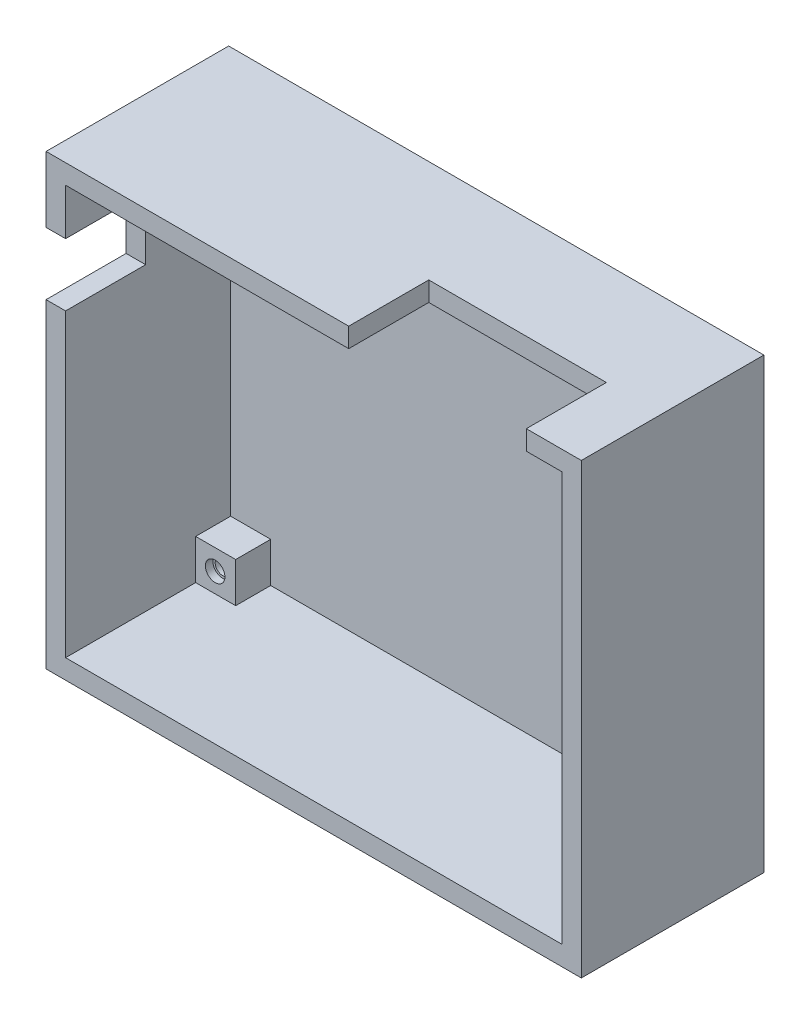
from build123d import *

# Parameters (mm, degrees)
ESBO_O1_W                = 107
ESBO_O1_H                = 89.6
RESSALTO_EXTRUS_O2_DEPTH = 36.5
CORTE_EXTRUS_O2_DEPTH    = 33
ESBO_O4_W                = 8
ESBO_O4_H                = 8
CORTE_EXTRUS_O3_DEPTH    = 26
ESBO_O5_W                = 83.2
ESBO_O5_H                = 3.9
ESBO_O5_H_2              = 4.1
CORTE_EXTRUS_O4_DEPTH    = 33
ESBO_O6_W                = 83.2
ESBO_O6_H                = 3.9
CORTE_EXTRUS_O5_DEPTH    = 33
ESBO_O7_W                = 35.5
ESBO_O7_H                = 3.9
CORTE_EXTRUS_O6_DEPTH    = 16
ESBO_O9_W                = 3.9
ESBO_O9_H                = 12.5
CORTE_EXTRUS_O7_DEPTH    = 16
ESBO_O10_R               = 1.95
CORTE_EXTRUS_O8_DEPTH    = 1.5
ESBO_O11_R               = 1.95
CORTE_EXTRUS_O9_DEPTH    = 1.5
ESBO_O12_R               = 1.95
CORTE_EXTRUS_O10_DEPTH   = 1.5
ESBO_O13_R               = 1.95
CORTE_EXTRUS_O11_DEPTH   = 1.5
ESBO_O14_R               = 1.5
CORTE_EXTRUS_O12_DEPTH   = 7
ESBO_O15_R               = 1.5
CORTE_EXTRUS_O13_DEPTH   = 7
ESBO_O16_R               = 1.5
CORTE_EXTRUS_O14_DEPTH   = 7
ESBO_O17_R               = 1.5
CORTE_EXTRUS_O15_DEPTH   = 7


with BuildPart() as part:
    # Esboço1 → Ressalto-extrusão2 (new body)
    with BuildSketch(Plane.XY):
        with Locations((53.5, -44.8)):
            Rectangle(ESBO_O1_W, ESBO_O1_H)
    extrude(amount=RESSALTO_EXTRUS_O2_DEPTH)

    # Esboço3 → Corte-extrusão2 (cut)
    with BuildSketch(Plane.XY.offset(36.5)):
        Polygon((95.1, -77.7), (95.1, -81.8), (11.9, -81.8), (11.9, -77.7), (7.8, -77.7), (3.9, -77.7), (3.9, -11.9), (11.9, -11.9), (11.9, -7.8), (95.1, -7.8), (95.1, -11.9), (99.2, -11.9), (103.1, -11.9), (103.1, -77.7), (99.2, -77.7), align=None)
    extrude(amount=-CORTE_EXTRUS_O2_DEPTH, mode=Mode.SUBTRACT)

    # Esboço4 → Corte-extrusão3 (cut)
    with BuildSketch(Plane.XY.offset(36.5)):
        Polygon((3.9, -11.9), (3.9, -3.9), (11.9, -3.9), (11.9, -7.8), (11.9, -11.9), align=None)
        Polygon((103.1, -11.9), (103.1, -3.9), (95.1, -3.9), (95.1, -7.8), (95.1, -11.9), align=None)
        with Locations((7.9, -81.7)):
            Rectangle(ESBO_O4_W, ESBO_O4_H)
        with Locations((99.1, -81.7)):
            Rectangle(ESBO_O4_W, ESBO_O4_H)
    extrude(amount=-CORTE_EXTRUS_O3_DEPTH, mode=Mode.SUBTRACT)

    # Esboço5 → Corte-extrusão4 (cut)
    with BuildSketch(Plane.XY.offset(36.5)):
        with Locations((53.5, -5.85)):
            Rectangle(ESBO_O5_W, ESBO_O5_H)
        with Locations((53.5, -79.75)):
            Rectangle(ESBO_O5_W, ESBO_O5_H_2)
    extrude(amount=-CORTE_EXTRUS_O4_DEPTH, mode=Mode.SUBTRACT)

    # Esboço6 → Corte-extrusão5 (cut)
    with BuildSketch(Plane.XY.offset(36.5)):
        with Locations((53.5, -83.75)):
            Rectangle(ESBO_O6_W, ESBO_O6_H)
    extrude(amount=-CORTE_EXTRUS_O5_DEPTH, mode=Mode.SUBTRACT)

    # Esboço7 → Corte-extrusão6 (cut)
    with BuildSketch(Plane.XY.offset(36.5)):
        with Locations((78.25, -1.95)):
            Rectangle(ESBO_O7_W, ESBO_O7_H)
    extrude(amount=-CORTE_EXTRUS_O6_DEPTH, mode=Mode.SUBTRACT)

    # Esboço9 → Corte-extrusão7 (cut)
    with BuildSketch(Plane.XY.offset(36.5)):
        with Locations((1.95, -19.41)):
            Rectangle(ESBO_O9_W, ESBO_O9_H)
    extrude(amount=-CORTE_EXTRUS_O7_DEPTH, mode=Mode.SUBTRACT)

    # Esboço10 → Corte-extrusão8 (cut)
    with BuildSketch(Plane.XY.offset(10.5)):
        with Locations((7.8, -7.8)):
            Circle(ESBO_O10_R)
    extrude(amount=-CORTE_EXTRUS_O8_DEPTH, mode=Mode.SUBTRACT)

    # Esboço11 → Corte-extrusão9 (cut)
    with BuildSketch(Plane.XY.offset(10.5)):
        with Locations((99.2, -7.8)):
            Circle(ESBO_O11_R)
    extrude(amount=-CORTE_EXTRUS_O9_DEPTH, mode=Mode.SUBTRACT)

    # Esboço12 → Corte-extrusão10 (cut)
    with BuildSketch(Plane.XY.offset(10.5)):
        with Locations((99.2, -81.8)):
            Circle(ESBO_O12_R)
    extrude(amount=-CORTE_EXTRUS_O10_DEPTH, mode=Mode.SUBTRACT)

    # Esboço13 → Corte-extrusão11 (cut)
    with BuildSketch(Plane.XY.offset(10.5)):
        with Locations((7.8, -81.8)):
            Circle(ESBO_O13_R)
    extrude(amount=-CORTE_EXTRUS_O11_DEPTH, mode=Mode.SUBTRACT)

    # Esboço14 → Corte-extrusão12 (cut)
    with BuildSketch(Plane.XY.offset(9)):
        with Locations((7.8, -7.8)):
            Circle(ESBO_O14_R)
    extrude(amount=-CORTE_EXTRUS_O12_DEPTH, mode=Mode.SUBTRACT)

    # Esboço15 → Corte-extrusão13 (cut)
    with BuildSketch(Plane.XY.offset(9)):
        with Locations((99.2, -7.8)):
            Circle(ESBO_O15_R)
    extrude(amount=-CORTE_EXTRUS_O13_DEPTH, mode=Mode.SUBTRACT)

    # Esboço16 → Corte-extrusão14 (cut)
    with BuildSketch(Plane.XY.offset(9)):
        with Locations((99.2, -81.8)):
            Circle(ESBO_O16_R)
    extrude(amount=-CORTE_EXTRUS_O14_DEPTH, mode=Mode.SUBTRACT)

    # Esboço17 → Corte-extrusão15 (cut)
    with BuildSketch(Plane.XY.offset(9)):
        with Locations((7.8, -81.8)):
            Circle(ESBO_O17_R)
    extrude(amount=-CORTE_EXTRUS_O15_DEPTH, mode=Mode.SUBTRACT)


solid = part.part
